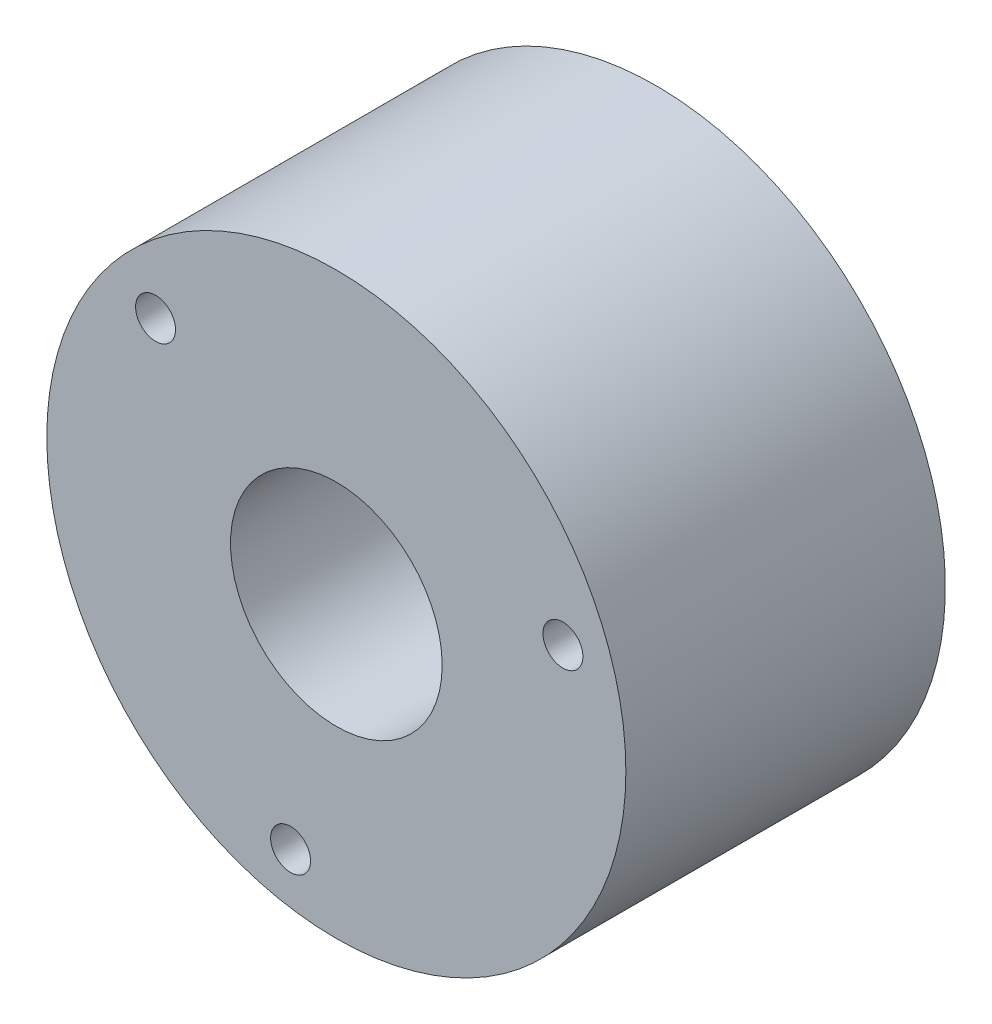
from build123d import *

# Parameters (mm, degrees)
SKETCH1_R           = 36.25
SKETCH1_R_2         = 13.25
BOSS_EXTRUDE1_DEPTH = 20
BOSS_EXTRUDE3_START = 20
SKETCH2_R           = 36.25
SKETCH2_R_2         = 5.5
BOSS_EXTRUDE3_DEPTH = 20
SKETCH3_R           = 2.5
CUT_EXTRUDE1_DEPTH  = 66.024034018


with BuildPart() as part:
    # Sketch1 → Boss-Extrude1 (new body)
    with BuildSketch(Plane.XY):
        Circle(SKETCH1_R)
        Circle(SKETCH1_R_2, mode=Mode.SUBTRACT)
    extrude(amount=BOSS_EXTRUDE1_DEPTH)

    # Sketch2 → Boss-Extrude3 (add)
    with BuildSketch(Plane(origin=(0, 0, 0), x_dir=(-1, 0, 0), z_dir=(0, 0, -1)).offset(BOSS_EXTRUDE3_START)):
        Circle(SKETCH2_R)
        Circle(SKETCH2_R_2, mode=Mode.SUBTRACT)
    extrude(amount=-BOSS_EXTRUDE3_DEPTH)

    # Sketch3 → Cut-Extrude1 (cut, through all)
    with BuildSketch(Plane.XY.offset(20)):
        with Locations((-5.731515756, -29.447406119)):
            Circle(SKETCH3_R)
        with Locations((-22.636443897, 19.687341306)):
            Circle(SKETCH3_R)
        with Locations((28.367959653, 9.760064813)):
            Circle(SKETCH3_R)
    extrude(amount=-CUT_EXTRUDE1_DEPTH, mode=Mode.SUBTRACT)


solid = part.part
